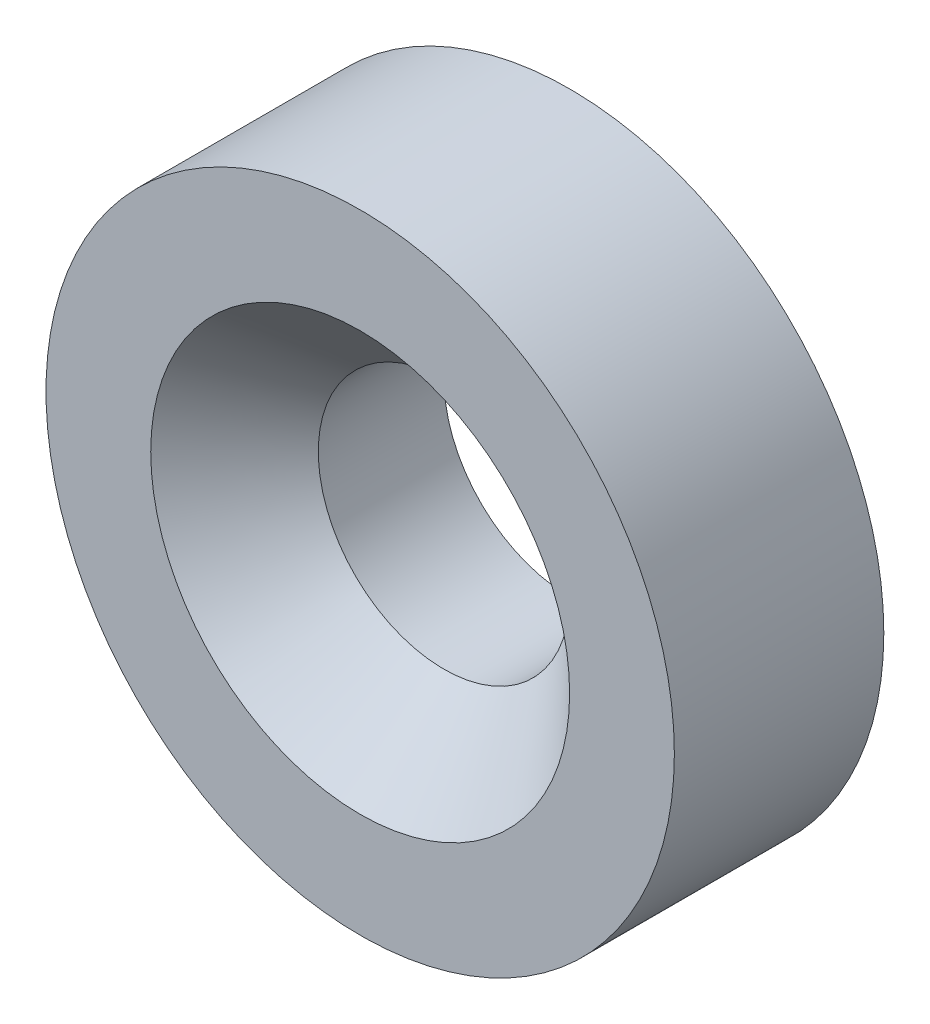
from build123d import *

# Parameters (mm, degrees)
SKETCH1_R           = 0.75
BOSS_EXTRUDE1_DEPTH = 0.5
SKETCH2_R           = 0.3
CUT_EXTRUDE1_DEPTH  = 2.17260394
CHAMFER1_SIZE       = 0.2


with BuildPart() as part:
    # Sketch1 → Boss-Extrude1 (new body)
    with BuildSketch(Plane.XY):
        Circle(SKETCH1_R)
    extrude(amount=BOSS_EXTRUDE1_DEPTH)

    # Sketch2 → Cut-Extrude1 (cut, through all)
    with BuildSketch(Plane.XY.offset(0.5)):
        Circle(SKETCH2_R)
    extrude(amount=-CUT_EXTRUDE1_DEPTH, mode=Mode.SUBTRACT)

    # Chamfer1
    chamfer1_edges = [part.edges().sort_by_distance(p)[0] for p in [
        (-0.3, 0, 0.5),
    ]]
    chamfer(chamfer1_edges, length=CHAMFER1_SIZE)


solid = part.part
